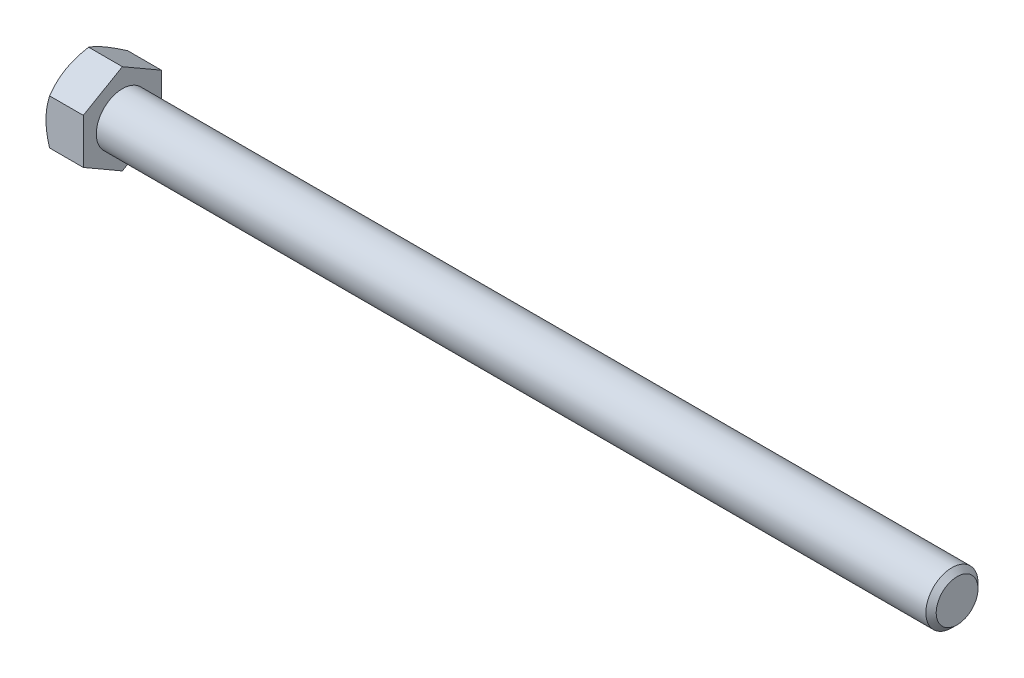
from build123d import *

# Parameters (mm, degrees)
BASEHEAD_DEPTH = 6.8072


with BuildPart() as part:
    # Sketch1 → BaseHead (new body)
    with BuildSketch(Plane(origin=(0, 0, 0), x_dir=(0, 0, -1), z_dir=(1, 0, 0))):
        Polygon((7.1374, 4.120779811), (7.1374, -4.120779811), (0, -8.241559623), (-7.1374, -4.120779811), (-7.1374, 4.120779811), (0, 8.241559623), align=None)
    extrude(amount=BASEHEAD_DEPTH)

    # BodySke → BaseBody (revolve)
    with BuildSketch(Plane.XY, mode=Mode.PRIVATE) as basebody_sk:
        Polygon((0, 0), (159.2072, 0), (159.2072, 3.81635), (158.26105, 4.7625), (0, 4.7625), align=None)
    revolve(basebody_sk.sketch.rotate(Axis((0, 0, 0), (1, 0, 0)), 90), axis=Axis((0, 0, 0), (1, 0, 0)))

    # Sketch3 → HeadChamfer (revolve, cut)
    with BuildSketch(Plane.XY):
        Polygon((0, 7.1374), (4.303661065, 14.591559623), (4.303661065, 20.941559623), (-12.7, 20.941559623), (-12.7, 7.1374), align=None)
    revolve(axis=Axis((0, 0, 0), (1, 0, 0)), mode=Mode.SUBTRACT)


solid = part.part
